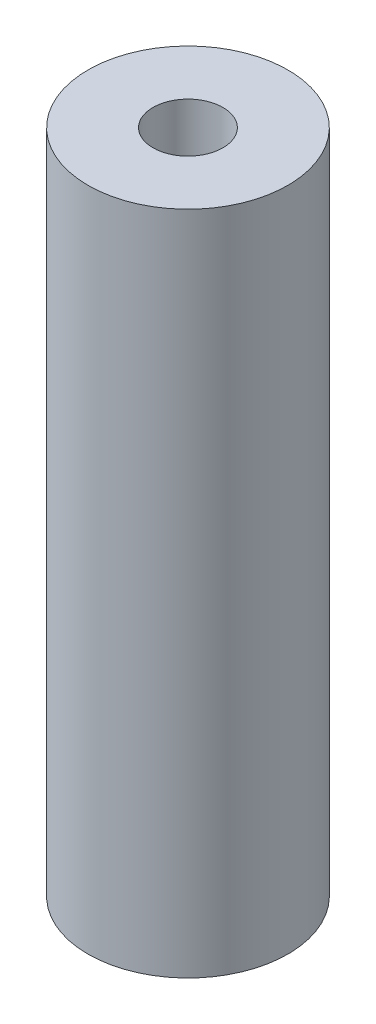
from build123d import *

# Parameters (mm, degrees)
SKETCH1_R           = 5
SKETCH1_R_2         = 1.75
BOSS_EXTRUDE1_DEPTH = 33.3


with BuildPart() as part:
    # Sketch1 → Boss-Extrude1 (new body)
    with BuildSketch(Plane(origin=(0, 0, 0), x_dir=(1, 0, 0), z_dir=(0, 1, 0))):
        with Locations(Location((0, 0, 0), (0, 0, 270))):
            Circle(SKETCH1_R)
        with Locations(Location((0, 0, 0), (0, 0, 270))):
            Circle(SKETCH1_R_2, mode=Mode.SUBTRACT)
    extrude(amount=BOSS_EXTRUDE1_DEPTH)


solid = part.part
